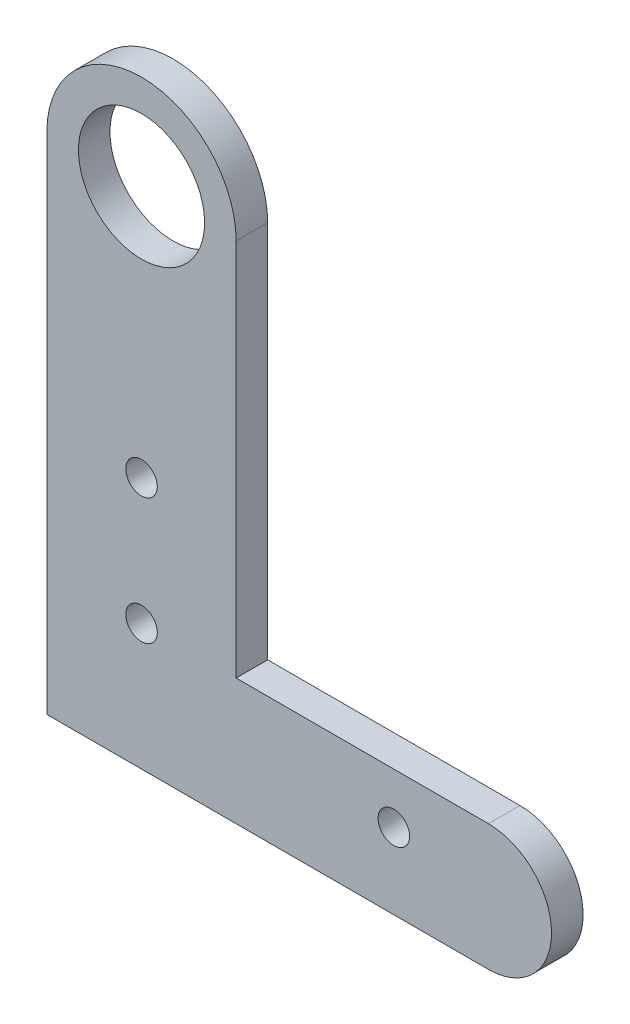
from build123d import *

# Parameters (mm, degrees)
SKETCH2_R           = 10
SKETCH2_R_2         = 2.5
BOSS_EXTRUDE1_DEPTH = 5


with BuildPart() as part:
    # Sketch2 → Boss-Extrude1 (new body)
    with BuildSketch(Plane.XY):
        with BuildLine():
            Line((0, 0), (70, 0))
            ThreePointArc((70, 0), (80, 10), (70, 20))
            Line((70, 20), (30, 20))
            Line((30, 20), (30, 80))
            ThreePointArc((30, 80), (15, 95), (0, 80))
            Line((0, 80), (0, 0))
        make_face()
        with Locations((15, 80)):
            Circle(SKETCH2_R, mode=Mode.SUBTRACT)
        with Locations((15, 20)):
            Circle(SKETCH2_R_2, mode=Mode.SUBTRACT)
        with Locations((15, 40)):
            Circle(SKETCH2_R_2, mode=Mode.SUBTRACT)
        with Locations((55, 12)):
            Circle(SKETCH2_R_2, mode=Mode.SUBTRACT)
    extrude(amount=BOSS_EXTRUDE1_DEPTH)


solid = part.part
